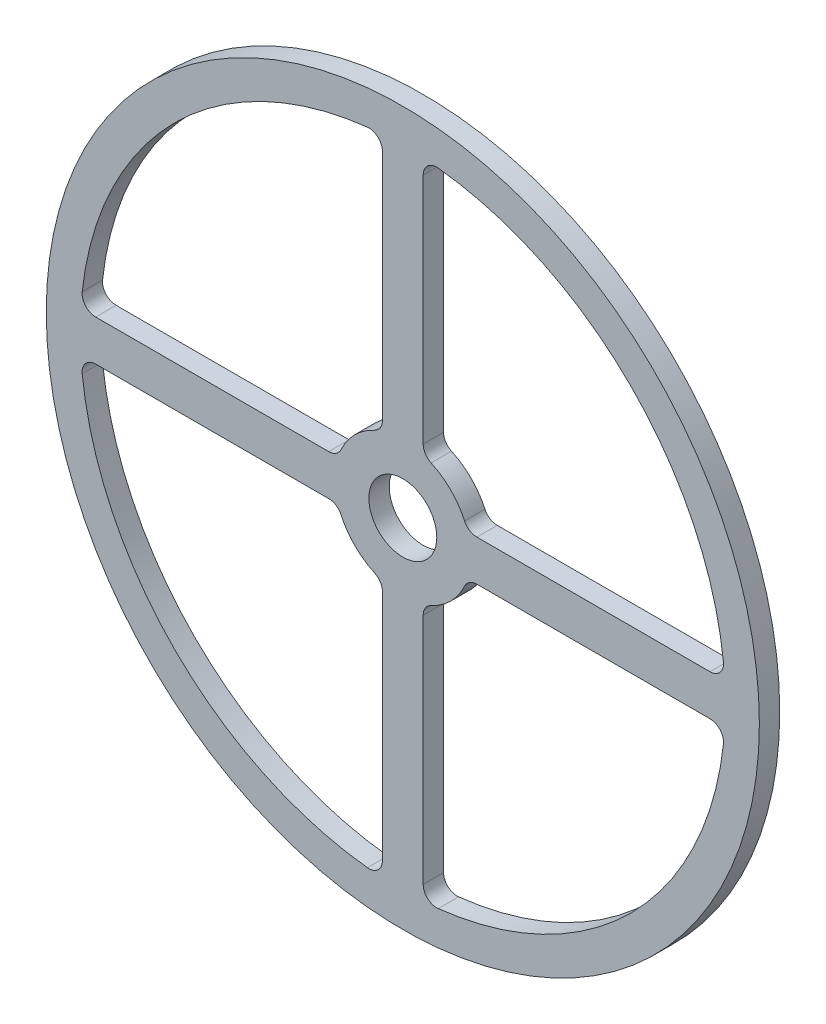
from build123d import *

# Parameters (mm, degrees)
SKETCH_1_R      = 52.5
SKETCH_1_R_2    = 5
EXTRUDE_1_DEPTH = 3
FILLET_1_R      = 2


with BuildPart() as part:
    # 草图1 → 凸台-拉伸1 (new body)
    with BuildSketch(Plane.XY):
        Circle(SKETCH_1_R)
        Circle(SKETCH_1_R_2, mode=Mode.SUBTRACT)
        with BuildLine():
            Line((3, 47.405168495), (3, 9.539392014))
            ThreePointArc((3, 9.539392014), (7.071067812, 7.071067812), (9.539392014, 3))
            Line((9.539392014, 3), (47.405168495, 3))
            ThreePointArc((47.405168495, 3), (33.587572106, 33.587572106), (3, 47.405168495))
        make_face(mode=Mode.SUBTRACT)
        with BuildLine():
            Line((3, -9.539392014), (3, -47.405168495))
            ThreePointArc((3, -47.405168495), (33.587572106, -33.587572106), (47.405168495, -3))
            Line((47.405168495, -3), (9.539392014, -3))
            ThreePointArc((9.539392014, -3), (7.071067812, -7.071067812), (3, -9.539392014))
        make_face(mode=Mode.SUBTRACT)
        with BuildLine():
            Line((-3, 47.405168495), (-3, 9.539392014))
            ThreePointArc((-3, 9.539392014), (-7.071067812, 7.071067812), (-9.539392014, 3))
            Line((-9.539392014, 3), (-47.405168495, 3))
            ThreePointArc((-47.405168495, 3), (-33.587572106, 33.587572106), (-3, 47.405168495))
        make_face(mode=Mode.SUBTRACT)
        with BuildLine():
            Line((-47.405168495, -3), (-9.539392014, -3))
            ThreePointArc((-9.539392014, -3), (-7.071067812, -7.071067812), (-3, -9.539392014))
            Line((-3, -9.539392014), (-3, -47.405168495))
            ThreePointArc((-3, -47.405168495), (-33.587572106, -33.587572106), (-47.405168495, -3))
        make_face(mode=Mode.SUBTRACT)
    extrude(amount=EXTRUDE_1_DEPTH)

    # 圆角1
    fillet_1_edges = [part.edges().sort_by_distance(p)[0] for p in [
        (-3, 47.405168495, 1.5),
        (-47.405168495, 3, 1.5),
        (-9.539392014, 3, 1.5),
        (-3, 9.539392014, 1.5),
        (3, -47.405168495, 1.5),
        (47.405168495, -3, 1.5),
        (9.539392014, -3, 1.5),
        (3, -9.539392014, 1.5),
        (-47.405168495, -3, 1.5),
        (-3, -47.405168495, 1.5),
        (-3, -9.539392014, 1.5),
        (-9.539392014, -3, 1.5),
        (3, 9.539392014, 1.5),
        (9.539392014, 3, 1.5),
        (47.405168495, 3, 1.5),
        (3, 47.405168495, 1.5),
    ]]
    fillet(fillet_1_edges, radius=FILLET_1_R)


solid = part.part
